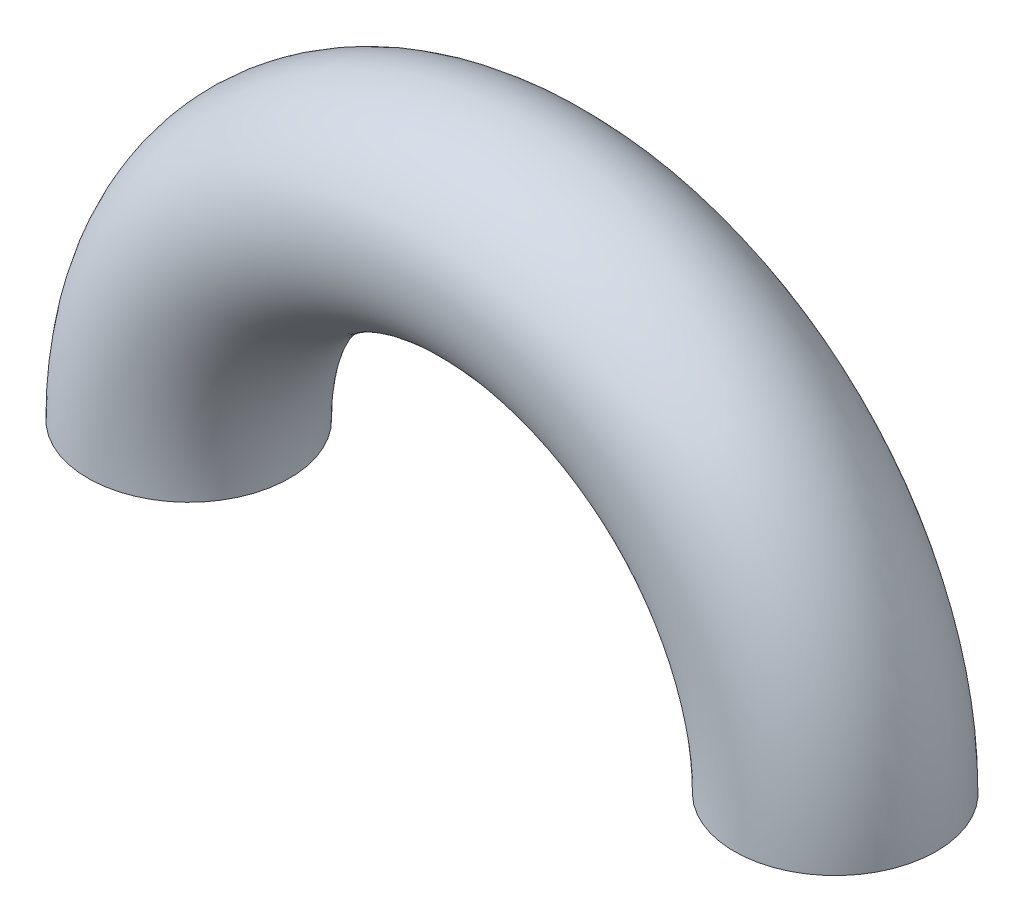
from build123d import *

# Parameters (mm, degrees)
SKETCH1_R = 1.5875


with BuildPart() as part:
    # Sweep1: sweep along a path in Sketch2
    with BuildLine(Plane.XY) as sweep1_path:
        ThreePointArc((0, 0), (5.08, 5.08), (10.16, 0))
    # Sketch1 → Sweep1 (sweep)
    with BuildSketch(Plane(origin=(0, 0, 0), x_dir=(1, 0, 0), z_dir=(0, 1, 0))):
        Circle(SKETCH1_R)
    sweep(path=sweep1_path.line)


solid = part.part
